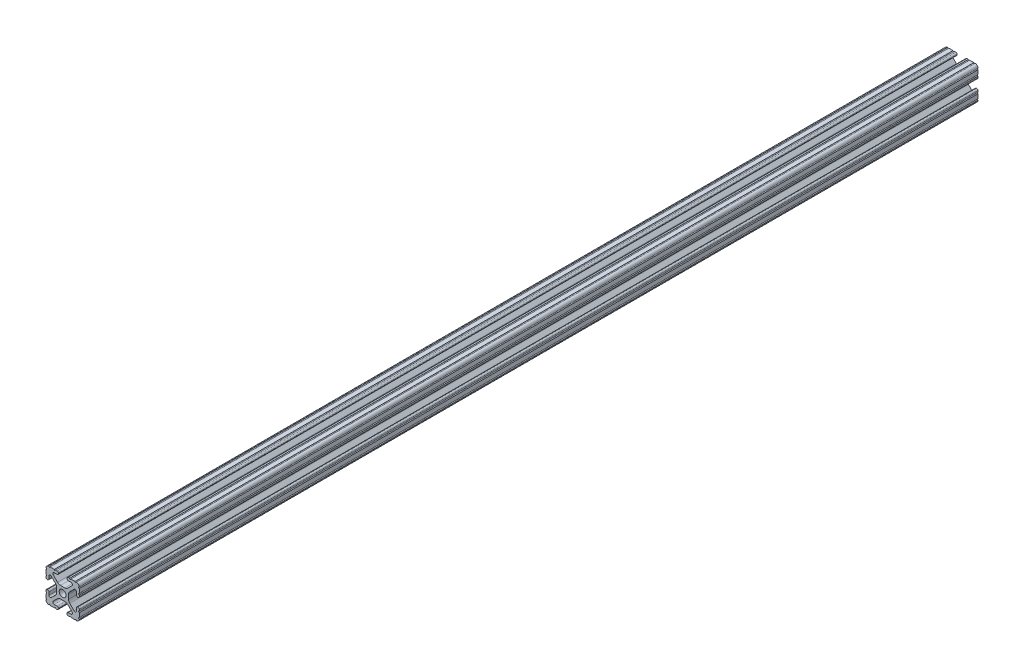
from build123d import *

# Parameters (mm, degrees)
SKETCH1_R           = 2.6035
BOSS_EXTRUDE1_DEPTH = 342.9


with BuildPart() as part:
    # Sketch1 → Boss-Extrude1 (new, symmetric)
    with BuildSketch(Plane.XY):
        with BuildLine():
            Line((-7.179650497, -8.645192506), (-3.952270251, -5.423690499))
            ThreePointArc((-3.952270251, -5.423690499), (-2.922936451, -4.736929036), (-1.709253557, -4.4958))
            Line((-1.709253557, -4.4958), (1.709253557, -4.4958))
            ThreePointArc((1.709253557, -4.4958), (2.922936451, -4.736929036), (3.952270251, -5.423690499))
            Line((3.952270251, -5.423690499), (7.179650497, -8.645192506))
            ThreePointArc((7.179650497, -8.645192506), (7.41473083, -9.822813117), (6.416408329, -10.4902))
            Line((6.416408329, -10.4902), (4.287512407, -10.4902))
            ThreePointArc((4.287512407, -10.4902), (3.54574862, -10.79744862), (3.2385, -11.539212407))
            Line((3.2385, -11.539212407), (3.2385, -11.650987593))
            ThreePointArc((3.2385, -11.650987593), (3.54574862, -12.39275138), (4.287512407, -12.7))
            Line((4.287512407, -12.7), (5.317126718, -12.7))
            ThreePointArc((5.317126718, -12.7), (5.825126718, -12.192), (6.333126718, -12.7))
            Line((6.333126718, -12.7), (9.550443118, -12.7))
            ThreePointArc((9.550443118, -12.7), (10.058366869, -12.192000006), (10.566443095, -12.699847501))
            ThreePointArc((10.566443095, -12.699847501), (12.082537762, -12.08250727), (12.699846982, -10.566399977))
            ThreePointArc((12.699846982, -10.566399977), (12.192000006, -10.058323491), (12.7, -9.5504))
            Line((12.7, -9.5504), (12.7, -6.3330836))
            ThreePointArc((12.7, -6.3330836), (12.192, -5.8250836), (12.7, -5.3170836))
            Line((12.7, -5.3170836), (12.7, -4.287469289))
            ThreePointArc((12.7, -4.287469289), (12.39275138, -3.545705502), (11.650987593, -3.238456882))
            Line((11.650987593, -3.238456882), (11.539212407, -3.238456882))
            ThreePointArc((11.539212407, -3.238456882), (10.79744862, -3.545705502), (10.4902, -4.287469289))
            Line((10.4902, -4.287469289), (10.4902, -6.402089023))
            ThreePointArc((10.4902, -6.402089023), (9.856505071, -7.351067942), (8.737131347, -7.129408934))
            Line((8.737131347, -7.129408934), (5.441005833, -3.840816462))
            ThreePointArc((5.441005833, -3.840816462), (4.750877967, -2.809883091), (4.5085, -1.593185507))
            Line((4.5085, -1.593185507), (4.5085, 1.593185507))
            ThreePointArc((4.5085, 1.593185507), (4.750877967, 2.809883091), (5.441005833, 3.840816462))
            Line((5.441005833, 3.840816462), (8.737131347, 7.129408934))
            ThreePointArc((8.737131347, 7.129408934), (9.856505071, 7.351067942), (10.4902, 6.402089023))
            Line((10.4902, 6.402089023), (10.4902, 4.287469289))
            ThreePointArc((10.4902, 4.287469289), (10.79744862, 3.545705502), (11.539212407, 3.238456882))
            Line((11.539212407, 3.238456882), (11.650987593, 3.238456882))
            ThreePointArc((11.650987593, 3.238456882), (12.39275138, 3.545705502), (12.7, 4.287469289))
            Line((12.7, 4.287469289), (12.7, 5.3170836))
            ThreePointArc((12.7, 5.3170836), (12.192, 5.8250836), (12.7, 6.3330836))
            Line((12.7, 6.3330836), (12.7, 9.5504))
            ThreePointArc((12.7, 9.5504), (12.192000006, 10.058323491), (12.699846982, 10.566399977))
            ThreePointArc((12.699846982, 10.566399977), (12.082537762, 12.08250727), (10.566443095, 12.699847501))
            ThreePointArc((10.566443095, 12.699847501), (10.058366869, 12.192000006), (9.550443118, 12.7))
            Line((9.550443118, 12.7), (6.333126718, 12.7))
            ThreePointArc((6.333126718, 12.7), (5.825126718, 12.192), (5.317126718, 12.7))
            Line((5.317126718, 12.7), (4.287512407, 12.7))
            ThreePointArc((4.287512407, 12.7), (3.54574862, 12.39275138), (3.2385, 11.650987593))
            Line((3.2385, 11.650987593), (3.2385, 11.539212407))
            ThreePointArc((3.2385, 11.539212407), (3.54574862, 10.79744862), (4.287512407, 10.4902))
            Line((4.287512407, 10.4902), (6.476788598, 10.4902))
            ThreePointArc((6.476788598, 10.4902), (7.432222385, 9.85140422), (7.207036008, 8.724370562))
            Line((7.207036008, 8.724370562), (3.898272566, 5.423169045))
            ThreePointArc((3.898272566, 5.423169045), (2.869120213, 4.736787962), (1.655778399, 4.4958))
            Line((1.655778399, 4.4958), (-1.655778399, 4.4958))
            ThreePointArc((-1.655778399, 4.4958), (-2.869120213, 4.736787962), (-3.898272566, 5.423169045))
            Line((-3.898272566, 5.423169045), (-7.207036008, 8.724370562))
            ThreePointArc((-7.207036008, 8.724370562), (-7.432222385, 9.85140422), (-6.476788598, 10.4902))
            Line((-6.476788598, 10.4902), (-4.287512407, 10.4902))
            ThreePointArc((-4.287512407, 10.4902), (-3.54574862, 10.79744862), (-3.2385, 11.539212407))
            Line((-3.2385, 11.539212407), (-3.2385, 11.650987593))
            ThreePointArc((-3.2385, 11.650987593), (-3.54574862, 12.39275138), (-4.287512407, 12.7))
            Line((-4.287512407, 12.7), (-5.317126718, 12.7))
            ThreePointArc((-5.317126718, 12.7), (-5.825126718, 12.192), (-6.333126718, 12.7))
            Line((-6.333126718, 12.7), (-9.550443118, 12.7))
            ThreePointArc((-9.550443118, 12.7), (-10.058366869, 12.192000006), (-10.566443095, 12.699847501))
            ThreePointArc((-10.566443095, 12.699847501), (-12.082537762, 12.08250727), (-12.699846982, 10.566399977))
            ThreePointArc((-12.699846982, 10.566399977), (-12.192000006, 10.058323491), (-12.7, 9.5504))
            Line((-12.7, 9.5504), (-12.7, 6.3330836))
            ThreePointArc((-12.7, 6.3330836), (-12.192, 5.8250836), (-12.7, 5.3170836))
            Line((-12.7, 5.3170836), (-12.7, 4.287469289))
            ThreePointArc((-12.7, 4.287469289), (-12.39275138, 3.545705502), (-11.650987593, 3.238456882))
            Line((-11.650987593, 3.238456882), (-11.539212407, 3.238456882))
            ThreePointArc((-11.539212407, 3.238456882), (-10.79744862, 3.545705502), (-10.4902, 4.287469289))
            Line((-10.4902, 4.287469289), (-10.4902, 6.402089023))
            ThreePointArc((-10.4902, 6.402089023), (-9.856505071, 7.351067942), (-8.737131347, 7.129408934))
            Line((-8.737131347, 7.129408934), (-5.441005833, 3.840816462))
            ThreePointArc((-5.441005833, 3.840816462), (-4.750877967, 2.809883091), (-4.5085, 1.593185507))
            Line((-4.5085, 1.593185507), (-4.5085, -1.593185507))
            ThreePointArc((-4.5085, -1.593185507), (-4.750877967, -2.809883091), (-5.441005833, -3.840816462))
            Line((-5.441005833, -3.840816462), (-8.737131347, -7.129408934))
            ThreePointArc((-8.737131347, -7.129408934), (-9.856505071, -7.351067942), (-10.4902, -6.402089023))
            Line((-10.4902, -6.402089023), (-10.4902, -4.287469289))
            ThreePointArc((-10.4902, -4.287469289), (-10.79744862, -3.545705502), (-11.539212407, -3.238456882))
            Line((-11.539212407, -3.238456882), (-11.650987593, -3.238456882))
            ThreePointArc((-11.650987593, -3.238456882), (-12.39275138, -3.545705502), (-12.7, -4.287469289))
            Line((-12.7, -4.287469289), (-12.7, -5.3170836))
            ThreePointArc((-12.7, -5.3170836), (-12.192, -5.8250836), (-12.7, -6.3330836))
            Line((-12.7, -6.3330836), (-12.7, -9.5504))
            ThreePointArc((-12.7, -9.5504), (-12.192000006, -10.058323491), (-12.699846982, -10.566399977))
            ThreePointArc((-12.699846982, -10.566399977), (-12.082537762, -12.08250727), (-10.566443095, -12.699847501))
            ThreePointArc((-10.566443095, -12.699847501), (-10.058366869, -12.192000006), (-9.550443118, -12.7))
            Line((-9.550443118, -12.7), (-6.333126718, -12.7))
            ThreePointArc((-6.333126718, -12.7), (-5.825126718, -12.192), (-5.317126718, -12.7))
            Line((-5.317126718, -12.7), (-4.287512407, -12.7))
            ThreePointArc((-4.287512407, -12.7), (-3.54574862, -12.39275138), (-3.2385, -11.650987593))
            Line((-3.2385, -11.650987593), (-3.2385, -11.539212407))
            ThreePointArc((-3.2385, -11.539212407), (-3.54574862, -10.79744862), (-4.287512407, -10.4902))
            Line((-4.287512407, -10.4902), (-6.416408329, -10.4902))
            ThreePointArc((-6.416408329, -10.4902), (-7.41473083, -9.822813117), (-7.179650497, -8.645192506))
        make_face()
        Circle(SKETCH1_R, mode=Mode.SUBTRACT)
    extrude(amount=BOSS_EXTRUDE1_DEPTH, both=True)


solid = part.part
